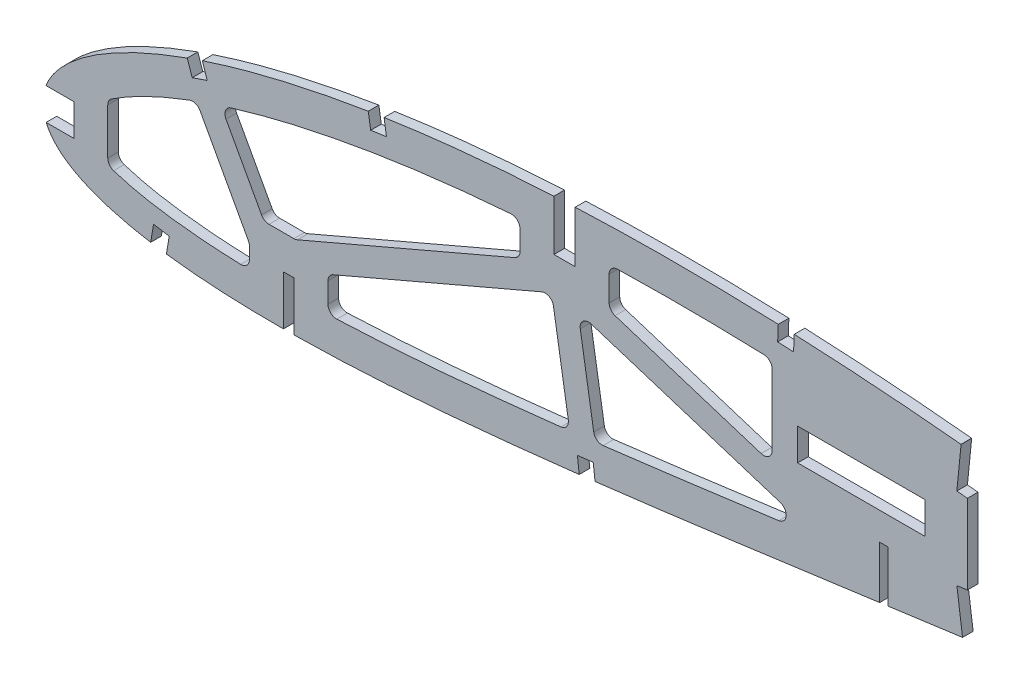
from build123d import *

# Parameters (mm, degrees)
BOSS_EXTRUDE1_DEPTH = 3.175
CUT_EXTRUDE1_DEPTH  = 7.62
SKETCH3_R           = 6.35
CUT_EXTRUDE2_DEPTH  = 7.62
SKETCH4_W           = 38.1
SKETCH4_H           = 9.525
SKETCH4_R           = 6.35
CUT_EXTRUDE3_DEPTH  = 443.627115857
CUT_EXTRUDE4_DEPTH  = 282.962875242
FILLET1_R           = 2.54


with BuildPart() as part:
    # Sketch1 → Boss-Extrude1 (new body)
    with BuildSketch(Plane.XY):
        with BuildLine():
            Line((435.33010469, 0.678691456), (439.172882547, -1.614212492))
            Line((439.172882547, -1.614212492), (434.787151486, -0.678691456))
            add(Edge.make_bspline(
                [(0, 0), (0.11179123, -0.527729161), (0.335887463, -1.58561283), (0.94472768, -3.108527015), (1.749889805, -4.572488672), (2.768272335, -5.973609192), (3.993104005, -7.311505618), (5.421679636, -8.587569541), (7.052598221, -9.801114861), (8.883725224, -10.951589231), (10.912400596, -12.040213999), (13.136344152, -13.066312264), (15.553528081, -14.029563428), (18.161318821, -14.928679795), (20.956528242, -15.765030781), (23.936498821, -16.536578215), (27.097842034, -17.244400464), (30.437517266, -17.886690773), (33.951885298, -18.464101669), (37.637295209, -18.976309975), (41.489964184, -19.423636044), (45.506112459, -19.80514129), (49.681767661, -20.121646285), (54.012767863, -20.373360955), (58.494909036, -20.561083494), (63.123897762, -20.684100336), (67.895200479, -20.744329207), (72.804505265, -20.742674403), (77.847009648, -20.678693244), (83.018406129, -20.555920262), (88.313732191, -20.373577887), (93.728207214, -20.133872554), (99.256947275, -19.839216685), (104.89499369, -19.49060908), (110.637384794, -19.089594814), (116.479134607, -18.639389777), (122.414936441, -18.141116951), (128.439613477, -17.597680601), (134.547832047, -17.011801372), (140.734314746, -16.385333349), (146.993600903, -15.721223571), (153.320115485, -15.021624036), (159.708476563, -14.290267097), (166.152848405, -13.528475979), (172.647781594, -12.740600204), (179.187166024, -11.928145018), (185.765533466, -11.094239816), (192.376967293, -10.242811017), (199.015278084, -9.37376151), (205.674882543, -8.493282903), (212.349358377, -7.600650086), (219.032895906, -6.7004538), (225.719308248, -5.795492203), (232.402082768, -4.886043807), (239.075345122, -3.975877517), (245.732904616, -3.06749205), (252.368240069, -2.160970285), (258.975348295, -1.26081803), (265.547576185, -0.366925322), (272.078863439, 0.518895586), (278.562951189, 1.394000598), (284.993721977, 2.257285217), (291.364542133, 3.108203268), (297.66900214, 3.947074317), (303.806375969, 4.748436439), (309.760626579, 5.554962658), (315.551818652, 6.216135275), (321.27090305, 6.780469964), (326.923820465, 7.243146515), (332.503782957, 7.610821489), (338.004397185, 7.886122043), (343.419107553, 8.072891719), (348.74107448, 8.176671364), (353.963650696, 8.200094537), (359.079707468, 8.150631139), (364.082590991, 8.032268225), (368.965318868, 7.850318702), (373.721079318, 7.610921079), (378.343117125, 7.320601554), (382.824493294, 6.983642622), (387.158963185, 6.607910686), (391.339839301, 6.198906082), (395.360701925, 5.761301701), (399.215684034, 5.304267166), (402.898615263, 4.830811549), (406.403955911, 4.348715399), (409.726063296, 3.862864382), (412.859676284, 3.379461168), (415.799871302, 2.903117573), (418.541899149, 2.440155772), (421.081464376, 1.994901374), (423.414160264, 1.571702591), (425.536750687, 1.175899009), (427.445043551, 0.809456817), (429.136486586, 0.478415007), (430.607934716, 0.184234372), (431.857230885, -0.068940506), (432.88219343, -0.280110359), (433.681265576, -0.445808771), (434.252869013, -0.566300363), (434.596385478, -0.637999126), (434.749014267, -0.670556399), (434.787151486, -0.678691456)],
                knots=[0, 0, 0, 0, 0.003638255, 0.007293231, 0.011028136, 0.014901081, 0.018963272, 0.023258475, 0.027820626, 0.032679082, 0.03785316, 0.043361875, 0.049214679, 0.055422346, 0.061988786, 0.068918036, 0.076211157, 0.083868392, 0.091887411, 0.100265912, 0.108999867, 0.118084529, 0.127514843, 0.13728527, 0.147387917, 0.157816481, 0.168563473, 0.179619128, 0.190977373, 0.202626974, 0.214560478, 0.226767249, 0.239236417, 0.251959004, 0.264923894, 0.278119703, 0.291536035, 0.30516028, 0.318980685, 0.332985499, 0.34716279, 0.361498603, 0.375980747, 0.390597192, 0.405332593, 0.420174823, 0.435109533, 0.450124276, 0.465203068, 0.480333154, 0.495500583, 0.510689775, 0.525887334, 0.541078314, 0.556247233, 0.571381785, 0.58646604, 0.601484515, 0.616424329, 0.631269423, 0.646006524, 0.660620684, 0.675098187, 0.689422858, 0.703581825, 0.716907563, 0.730009274, 0.742952128, 0.755725557, 0.768319951, 0.780724337, 0.792926528, 0.804916041, 0.816679084, 0.828203525, 0.8394749, 0.850481359, 0.861207697, 0.871639326, 0.881763414, 0.891563605, 0.901027365, 0.910138977, 0.918883977, 0.927249278, 0.935221104, 0.942784739, 0.949928188, 0.956638465, 0.962904203, 0.968712288, 0.974054485, 0.978918432, 0.983297219, 0.987180246, 0.990560674, 0.993433357, 0.995790626, 0.997629588, 0.998945816, 0.999736592, 1, 1, 1, 1], degree=3))
            add(Edge.make_bspline(
                [(435.33010469, 0.678691456), (435.296755582, 0.699293055), (435.163488681, 0.781619431), (434.863214309, 0.965803828), (434.363194901, 1.272571896), (433.663211466, 1.69979322), (432.763807452, 2.246333125), (431.664530435, 2.908364558), (430.366066728, 3.683736897), (428.86873043, 4.568782589), (427.172675107, 5.559358025), (425.278546429, 6.651449737), (423.186509465, 7.838875427), (420.897374442, 9.116782681), (418.411926851, 10.4790944), (415.730636684, 11.919657082), (412.854464224, 13.43114364), (409.784513475, 15.00705265), (406.521344218, 16.638681918), (403.066494801, 18.319240705), (399.421116368, 20.040349747), (395.586453278, 21.79282696), (391.56470833, 23.569527811), (387.356993489, 25.359407096), (382.965706604, 27.15470981), (378.392717175, 28.945218407), (373.640732922, 30.722778715), (368.711587102, 32.475875028), (363.608964359, 34.196846251), (358.335340013, 35.87451254), (352.894485425, 37.499762392), (347.289561815, 39.062058655), (341.52524157, 40.553388886), (335.605180365, 41.962892679), (329.534395845, 43.28113527), (323.317713598, 44.500180123), (316.960347344, 45.607856696), (310.479914041, 46.603301327), (303.980682286, 47.431342852), (297.494822244, 48.243461645), (291.0186212, 49.006373108), (284.46326746, 49.736966294), (277.835067652, 50.431127833), (271.140596349, 51.086687253), (264.386630807, 51.700815013), (257.580189535, 52.27171033), (250.727858804, 52.796138155), (243.836864005, 53.273290553), (236.914017847, 53.698972807), (229.966694004, 54.072865307), (223.001944897, 54.392360355), (216.027018499, 54.655256617), (209.049321182, 54.859966995), (202.076096041, 55.004530305), (195.114893299, 55.088037667), (188.172953688, 55.108207309), (181.257823923, 55.064678381), (174.376745271, 54.95595632), (167.537272154, 54.780552763), (160.7466557, 54.538140281), (154.012238926, 54.228824112), (147.341395315, 53.850013849), (140.741361553, 53.404123644), (134.219487317, 52.889280335), (127.782938298, 52.305347044), (121.438460058, 51.65475786), (115.193116172, 50.935743156), (109.053599754, 50.150348891), (103.026626206, 49.300114834), (97.118957953, 48.384577869), (91.33692342, 47.406382542), (85.686763085, 46.366529581), (80.174454785, 45.268067638), (74.805999973, 44.111283189), (69.587081438, 42.899646299), (64.52312301, 41.635267927), (59.619568317, 40.320462769), (54.881388132, 38.958385816), (50.313373811, 37.552127128), (45.920850559, 36.103231966), (41.707138151, 34.617193881), (37.677412709, 33.095067788), (33.834761135, 31.541542875), (30.183686712, 29.958740393), (26.726916941, 28.351485511), (23.468364091, 26.721608068), (20.41035055, 25.073674406), (17.555946308, 23.410211446), (14.907899047, 21.73430892), (12.467321746, 20.050217809), (10.237579271, 18.35899521), (8.219437586, 16.664914738), (6.414173801, 14.97055608), (4.824368385, 13.277086383), (3.449964137, 11.587487839), (2.292762263, 9.903098559), (1.352963468, 8.225512409), (0.632693499, 6.555947979), (0.13123808, 4.895344207), (-0.143255259, 3.246152095), (-0.211578297, 1.607049514), (-0.07042072, 0.534882766), (0, 0)],
                knots=[0, 0, 0, 0, 0.00025409, 0.001015373, 0.002283359, 0.004056577, 0.006330982, 0.009105274, 0.012374489, 0.016134023, 0.02037966, 0.025105976, 0.030306237, 0.035972206, 0.042099522, 0.048678064, 0.055701664, 0.063160184, 0.071045824, 0.079349826, 0.08806291, 0.097175756, 0.106678112, 0.116561573, 0.126814275, 0.137428301, 0.148393618, 0.15969976, 0.171338126, 0.183297699, 0.195569604, 0.208143556, 0.221011593, 0.234161831, 0.24758745, 0.261276822, 0.27522271, 0.289414144, 0.303771199, 0.317689227, 0.331784111, 0.346039677, 0.36044387, 0.37498272, 0.389640454, 0.404403316, 0.419256601, 0.434186749, 0.449177265, 0.464214782, 0.479284009, 0.49436974, 0.509457833, 0.524532346, 0.53957932, 0.554582984, 0.569529546, 0.584403417, 0.599190992, 0.613876838, 0.628447475, 0.642888675, 0.657186054, 0.671325546, 0.685294014, 0.699078147, 0.712665095, 0.726042645, 0.739197713, 0.752117586, 0.764792042, 0.777208152, 0.789355685, 0.80122396, 0.812803686, 0.824082909, 0.835054602, 0.845709571, 0.856037853, 0.866033834, 0.875688843, 0.884997719, 0.893953426, 0.902552897, 0.910789386, 0.918660734, 0.926166253, 0.933302626, 0.94007122, 0.94647478, 0.952517526, 0.958204819, 0.963546652, 0.9685566, 0.973249913, 0.977651041, 0.981787043, 0.985694226, 0.989415109, 0.993001157, 0.996508416, 1, 1, 1, 1], degree=3))
        make_face()
    extrude(amount=BOSS_EXTRUDE1_DEPTH)

    # Sketch2 → Cut-Extrude1 (cut)
    with BuildSketch(Plane(origin=(0, 0, 0), x_dir=(-1, 0, 0), z_dir=(0, 0, -1))):
        Polygon((-252.794440989, 13.221493744), (-250.254440989, 13.221493744), (-250.254440989, -2.115243028), (-250.254440989, -3.986349358), (-252.794440989, -3.050796193), (-252.794440989, -2.115243028), align=None)
        Polygon((-159.131940989, 54.422217902), (-159.131940989, 39.039100326), (-152.781940989, 39.039100326), (-152.781940989, 54.422217902), (-152.781940989, 57.645440557), (-159.131940989, 55.540936844), align=None)
        Polygon((-74.994440989, -5.928775484), (-74.994440989, -20.141805429), (-74.994440989, -20.97642061), (-71.819440989, -22.145862066), (-71.819440989, -20.141805429), (-71.819440989, -5.928775484), align=None)
    extrude(amount=-CUT_EXTRUDE1_DEPTH, mode=Mode.SUBTRACT)

    # Sketch3 → Cut-Extrude2 (cut)
    with BuildSketch(Plane(origin=(0, 0, 0), x_dir=(-1, 0, 0), z_dir=(0, 0, -1))):
        with Locations((-292.383806588, 26.255421435)):
            Circle(SKETCH3_R)
    extrude(amount=-CUT_EXTRUDE2_DEPTH, mode=Mode.SUBTRACT)

    # Sketch4 → Cut-Extrude3 (cut, through all)
    # profile 1 of 12: a face of its own
    with BuildSketch(Plane.XY.offset(3.175)):
        with BuildLine():
            Line((9.08354865, 6.810338827), (0.76430461, 6.810338827))
            add(Edge.make_bspline(
                [(0.76430461, 6.810338827), (0.726676763, 6.71299191), (0.488212559, 6.077489506), (0.13123808, 4.895344207), (-0.143255259, 3.246152095), (-0.211578297, 1.607049514), (-0.07042072, 0.534882766), (0, 0)],
                knots=[0.98501809, 0.98501809, 0.98501809, 0.98501809, 0.985694226, 0.989415109, 0.993001157, 0.996508416, 1, 1, 1, 1], degree=3))
            add(Edge.make_bspline(
                [(0, 0), (0.11179123, -0.527729161), (0.307969583, -1.453821818), (0.640979835, -2.341032636), (0.803006074, -2.714661173)],
                knots=[0, 0, 0, 0, 0.003638255, 0.006384641, 0.006384641, 0.006384641, 0.006384641], degree=3))
            Line((0.803006074, -2.714661173), (9.08354865, -2.714661173))
            Line((9.08354865, -2.714661173), (9.08354865, 6.810338827))
        make_face()
    # profile 2 of 12: a face of its own
    with BuildSketch(Plane.XY.offset(3.175)):
        with BuildLine():
            Line((49.020517996, 32.253888691), (47.531675541, 36.629642878))
            add(Edge.make_bspline(
                [(47.531675541, 36.629642878), (46.979087567, 36.445759538), (45.474608141, 35.938686183), (43.975608762, 35.415532918), (43.028960398, 35.077347923)],
                knots=[0.862258912, 0.862258912, 0.862258912, 0.862258912, 0.866033834, 0.872549698, 0.872549698, 0.872549698, 0.872549698], degree=3))
            Line((43.028960398, 35.077347923), (44.512019179, 30.71972624))
            Line((44.512019179, 30.71972624), (49.020517996, 32.253888691))
        make_face()
    # profile 3 of 12: a face of its own
    with BuildSketch(Plane.XY.offset(3.175)):
        Polygon((36.838817299, -18.581245887), (32.165910286, -17.731153874), (32.952371753, -13.02357497), (37.641753761, -13.808241987), align=None)
    # profile 4 of 12: a face of its own
    with BuildSketch(Plane.XY.offset(3.175)):
        with BuildLine():
            Line((102.645386654, 44.510393866), (101.9478561, 49.125267329))
            add(Edge.make_bspline(
                [(101.9478561, 49.125267329), (100.365650198, 48.887111331), (98.784740474, 48.64033843), (97.205261705, 48.38471328)],
                knots=[0.741480352, 0.741480352, 0.741480352, 0.741480352, 0.751851659, 0.751851659, 0.751851659, 0.751851659], degree=3))
            Line((97.205261705, 48.38471328), (97.936400792, 43.798607145))
            Line((97.936400792, 43.798607145), (102.645386654, 44.510393866))
        make_face()
    # profile 5 of 12: a face of its own
    with BuildSketch(Plane.XY.offset(3.175)):
        with BuildLine():
            add(Edge.make_bspline(
                [(160.340338786, -14.212647666), (161.920044437, -14.028275741), (163.499504121, -13.841797301), (165.078745983, -13.653492366)],
                knots=[0.377458898, 0.377458898, 0.377458898, 0.377458898, 0.388202054, 0.388202054, 0.388202054, 0.388202054], degree=3))
            Line((165.078745983, -13.653492366), (164.522590598, -8.953423812))
            Line((164.522590598, -8.953423812), (159.793087001, -9.513059826))
            Line((159.793087001, -9.513059826), (160.340338786, -14.212647666))
        make_face()
    # profile 6 of 12: a face of its own
    with BuildSketch(Plane.XY.offset(3.175)):
        with BuildLine():
            Line((224.483551568, 49.643099482), (224.695252101, 54.310425843))
            add(Edge.make_bspline(
                [(224.695252101, 54.310425843), (224.131555977, 54.335094277), (222.536497131, 54.403324951), (220.941251233, 54.467084737), (219.909719875, 54.506423891)],
                knots=[0.475626644, 0.475626644, 0.475626644, 0.475626644, 0.479284009, 0.485975235, 0.485975235, 0.485975235, 0.485975235], degree=3))
            Line((219.909719875, 54.506423891), (219.725798523, 49.849814949))
            Line((219.725798523, 49.849814949), (224.483551568, 49.643099482))
        make_face()
    # profile 7 of 12: a face of its own
    with BuildSketch(Plane.XY.offset(3.175)):
        with Locations((244.758806588, 26.255421435)):
            Rectangle(SKETCH4_W, SKETCH4_H)
    # profile 8 of 12: a face of its own
    with BuildSketch(Plane.XY.offset(3.175)):
        Polygon((276.508806588, 37.713859181), (277.787367709, 50.342830172), (274.606587067, 50.664683683), (273.349658498, 38.028091323), align=None)
    # profile 9 of 12: a face of its own
    with BuildSketch(Plane.XY.offset(3.175)):
        with BuildLine():
            Line((274.606587067, 50.745349283), (274.606587067, 50.664683683))
            Line((274.606587067, 50.664683683), (277.787367709, 50.342830172))
            Line((277.787367709, 50.342830172), (276.508806588, 37.713859181))
            Line((276.508806588, 37.713859181), (276.508806588, 13.934637567))
            Line((276.508806588, 13.934637567), (278.202158297, 1.347675194))
            Line((278.202158297, 1.347675194), (275.057635426, 0.924468904))
            Line((275.057635426, 0.924468904), (275.057635426, 0.920727129))
            add(Edge.make_bspline(
                [(275.057635426, 0.920727129), (276.232091103, 1.079260303), (279.550679689, 1.526596029), (284.993721977, 2.257285217), (291.364542133, 3.108203268), (297.66900214, 3.947074317), (303.806375969, 4.748436439), (309.760626579, 5.554962658), (315.551818652, 6.216135275), (321.27090305, 6.780469964), (326.923820465, 7.243146515), (332.503782957, 7.610821489), (338.004397185, 7.886122043), (343.419107553, 8.072891719), (348.74107448, 8.176671364), (353.963650696, 8.200094537), (359.079707468, 8.150631139), (364.082590991, 8.032268225), (368.965318868, 7.850318702), (373.721079318, 7.610921079), (378.343117125, 7.320601554), (382.824493294, 6.983642622), (387.158963185, 6.607910686), (391.339839301, 6.198906082), (395.360701925, 5.761301701), (399.215684034, 5.304267166), (402.898615263, 4.830811549), (406.403955911, 4.348715399), (409.726063296, 3.862864382), (412.859676284, 3.379461168), (415.799871302, 2.903117573), (418.541899149, 2.440155772), (421.081464376, 1.994901374), (423.414160264, 1.571702591), (425.536750687, 1.175899009), (427.445043551, 0.809456817), (429.136486586, 0.478415007), (430.607934716, 0.184234372), (431.857230885, -0.068940506), (432.88219343, -0.280110359), (433.681265576, -0.445808771), (434.252869013, -0.566300363), (434.596385478, -0.637999126), (434.749014267, -0.670556399), (434.787151486, -0.678691456)],
                knots=[0.638001263, 0.638001263, 0.638001263, 0.638001263, 0.646006524, 0.660620684, 0.675098187, 0.689422858, 0.703581825, 0.716907563, 0.730009274, 0.742952128, 0.755725557, 0.768319951, 0.780724337, 0.792926528, 0.804916041, 0.816679084, 0.828203525, 0.8394749, 0.850481359, 0.861207697, 0.871639326, 0.881763414, 0.891563605, 0.901027365, 0.910138977, 0.918883977, 0.927249278, 0.935221104, 0.942784739, 0.949928188, 0.956638465, 0.962904203, 0.968712288, 0.974054485, 0.978918432, 0.983297219, 0.987180246, 0.990560674, 0.993433357, 0.995790626, 0.997629588, 0.998945816, 0.999736592, 1, 1, 1, 1], degree=3))
            Line((434.787151486, -0.678691456), (439.172882547, -1.614212492))
            Line((439.172882547, -1.614212492), (435.33010469, 0.678691456))
            add(Edge.make_bspline(
                [(435.33010469, 0.678691456), (435.296755582, 0.699293055), (435.163488681, 0.781619431), (434.863214309, 0.965803828), (434.363194901, 1.272571896), (433.663211466, 1.69979322), (432.763807452, 2.246333125), (431.664530435, 2.908364558), (430.366066728, 3.683736897), (428.86873043, 4.568782589), (427.172675107, 5.559358025), (425.278546429, 6.651449737), (423.186509465, 7.838875427), (420.897374442, 9.116782681), (418.411926851, 10.4790944), (415.730636684, 11.919657082), (412.854464224, 13.43114364), (409.784513475, 15.00705265), (406.521344218, 16.638681918), (403.066494801, 18.319240705), (399.421116368, 20.040349747), (395.586453278, 21.79282696), (391.56470833, 23.569527811), (387.356993489, 25.359407096), (382.965706604, 27.15470981), (378.392717175, 28.945218407), (373.640732922, 30.722778715), (368.711587102, 32.475875028), (363.608964359, 34.196846251), (358.335340013, 35.87451254), (352.894485425, 37.499762392), (347.289561815, 39.062058655), (341.52524157, 40.553388886), (335.605180365, 41.962892679), (329.534395845, 43.28113527), (323.317713598, 44.500180123), (316.960347344, 45.607856696), (310.479914041, 46.603301327), (303.980682286, 47.431342852), (297.494822244, 48.243461645), (291.0186212, 49.006373108), (284.46326746, 49.736966294), (278.983592298, 50.31084455), (275.689561404, 50.639206846), (274.606587067, 50.745349283)],
                knots=[0, 0, 0, 0, 0.00025409, 0.001015373, 0.002283359, 0.004056577, 0.006330982, 0.009105274, 0.012374489, 0.016134023, 0.02037966, 0.025105976, 0.030306237, 0.035972206, 0.042099522, 0.048678064, 0.055701664, 0.063160184, 0.071045824, 0.079349826, 0.08806291, 0.097175756, 0.106678112, 0.116561573, 0.126814275, 0.137428301, 0.148393618, 0.15969976, 0.171338126, 0.183297699, 0.195569604, 0.208143556, 0.221011593, 0.234161831, 0.24758745, 0.261276822, 0.27522271, 0.289414144, 0.303771199, 0.317689227, 0.331784111, 0.346039677, 0.36044387, 0.367497329, 0.367497329, 0.367497329, 0.367497329], degree=3))
        make_face()
        with Locations((292.383806588, 26.255421435)):
            Circle(SKETCH4_R, mode=Mode.SUBTRACT)
    # profile 10 of 12: a face of its own
    with BuildSketch(Plane.XY.offset(3.175)):
        Polygon((273.362227422, 13.510785566), (275.057635426, 0.924468904), (278.202158297, 1.347675194), (276.508806588, 13.934637567), align=None)
    # profile 11 of 12: a face of its own
    with BuildSketch(Plane.XY.offset(3.175)):
        with BuildLine():
            add(Edge.make_bspline(
                [(32.095086313, -18.155090016), (32.696595442, -18.254411923), (34.259232792, -18.501714728), (35.825676123, -18.723786999), (36.789618427, -18.851689263)],
                knots=[0.087769382, 0.087769382, 0.087769382, 0.087769382, 0.091887411, 0.098455639, 0.098455639, 0.098455639, 0.098455639], degree=3))
            Line((32.095086313, -18.155090016), (31.569110721, -21.303459904))
            Line((31.569110721, -21.303459904), (36.2027681, -22.077571832))
            Line((36.2027681, -22.077571832), (36.789618427, -18.851689263))
        make_face()
    # profile 12 of 12: a face of its own
    with BuildSketch(Plane.XY.offset(3.175)):
        with BuildLine():
            Line((32.165910286, -17.731153874), (32.095086313, -18.155090016))
            add(Edge.make_bspline(
                [(32.095086313, -18.155090016), (32.696595442, -18.254411923), (34.259232792, -18.501714728), (35.825676123, -18.723786999), (36.789618427, -18.851689263)],
                knots=[0.087769382, 0.087769382, 0.087769382, 0.087769382, 0.091887411, 0.098455639, 0.098455639, 0.098455639, 0.098455639], degree=3))
            Line((36.789618427, -18.851689263), (36.838817299, -18.581245887))
            Line((36.838817299, -18.581245887), (32.165910286, -17.731153874))
        make_face()
    extrude(amount=-CUT_EXTRUDE3_DEPTH, mode=Mode.SUBTRACT)

    # Sketch5 → Cut-Extrude4 (cut, through all)
    with BuildSketch(Plane.XY.offset(3.175)):
        with BuildLine():
            add(Edge.make_bspline(
                [(45.814840569, 25.282367443), (43.822791815, 24.562865162), (39.215196122, 22.812244039), (32.181765676, 19.775215547), (26.104065444, 16.671015264), (22.150956813, 14.309546417), (20.27302683, 13.083140574), (19.503800794, 12.556245905), (19.24354865, 12.374877898)],
                knots=[0.874077053, 0.874077053, 0.874077053, 0.874077053, 0.888527775, 0.907825838, 0.927123901, 0.936772932, 0.94141287, 0.943825127, 0.943825127, 0.943825127, 0.943825127], degree=3))
            Line((19.24354865, 12.374877898), (19.24354865, -4.539137798))
            add(Edge.make_bspline(
                [(19.24354865, -4.539137798), (19.525981613, -4.642890342), (20.216795523, -4.889295377), (22.0966215, -5.515008888), (26.203155938, -6.690360656), (32.713182772, -8.045600453), (40.841334575, -9.183638157), (49.096619858, -9.934839763), (55.360075179, -10.273048988), (59.539003509, -10.420924337), (60.952190291, -10.460753472), (61.659440989, -10.478274979)],
                knots=[0.049763351, 0.049763351, 0.049763351, 0.049763351, 0.052230608, 0.055729778, 0.065598805, 0.08533686, 0.105074914, 0.124812969, 0.144188224, 0.149122738, 0.154057251, 0.154057251, 0.154057251, 0.154057251], degree=3))
            Line((61.659440989, -10.478274979), (61.659440989, -3.714397612))
            Line((61.659440989, -3.714397612), (45.814840569, 25.282367443))
        make_face()
        with BuildLine():
            add(Edge.make_bspline(
                [(142.621940989, 43.341052807), (141.16277336, 43.237100158), (137.894505535, 42.99177607), (128.804678048, 42.228619487), (115.386854733, 40.817080153), (98.089203191, 38.358558503), (80.973623404, 35.187832938), (66.936657893, 31.856735994), (57.726991023, 29.21501171), (54.069296834, 28.07024065), (53.137796451, 27.772072652)],
                knots=[0.654625525, 0.654625525, 0.654625525, 0.654625525, 0.664274557, 0.676249084, 0.714845209, 0.753441335, 0.792037461, 0.830633587, 0.84993165, 0.856554759, 0.856554759, 0.856554759, 0.856554759], degree=3))
            Line((53.137796451, 27.772072652), (66.001139364, 4.231224516))
            Line((66.001139364, 4.231224516), (75.488690109, 4.231224516))
            Line((75.488690109, 4.231224516), (142.621940989, 33.024751821))
            Line((142.621940989, 33.024751821), (142.621940989, 43.341052807))
        make_face()
        with BuildLine():
            Line((85.154440989, 0.085573021), (85.154440989, -10.31403894))
            add(Edge.make_bspline(
                [(85.154440989, -10.31403894), (90.221688375, -10.141635354), (101.039010532, -9.613219564), (117.637914667, -8.40013339), (136.679570306, -6.638548813), (149.971615588, -5.18667662), (157.497572739, -4.315203925)],
                knots=[0.208311845, 0.208311845, 0.208311845, 0.208311845, 0.243241296, 0.282717405, 0.322193514, 0.373662797, 0.373662797, 0.373662797, 0.373662797], degree=3))
            Line((157.497572739, -4.315203925), (152.109291457, 28.802584187))
            Line((152.109291457, 28.802584187), (85.154440989, 0.085573021))
        make_face()
        with BuildLine():
            Line((159.987096536, 27.833886694), (165.07247877, -3.422204529))
            add(Edge.make_bspline(
                [(165.07247877, -3.422204529), (166.566956941, -3.243055154), (179.610552739, -1.664978362), (201.671667742, 1.19592823), (222.259411165, 3.987166397), (231.282036291, 5.215897599)],
                knots=[0.390928193, 0.390928193, 0.390928193, 0.390928193, 0.401145733, 0.480097951, 0.541640306, 0.541640306, 0.541640306, 0.541640306], degree=3))
            Line((231.282036291, 5.215897599), (159.987096536, 27.833886694))
        make_face()
        with BuildLine():
            add(Edge.make_bspline(
                [(218.088806588, 44.407248442), (215.149456111, 44.514285011), (209.270778872, 44.697237468), (195.225915283, 44.981634592), (181.89596248, 44.964543834), (171.518848439, 44.720101194), (169.291940989, 44.656607646)],
                knots=[0.489112922, 0.489112922, 0.489112922, 0.489112922, 0.508410985, 0.527709048, 0.581332198, 0.595990863, 0.595990863, 0.595990863, 0.595990863], degree=3))
            Line((169.291940989, 44.656607646), (169.291940989, 32.87623272))
            Line((169.291940989, 32.87623272), (218.088806588, 17.395653345))
            Line((218.088806588, 17.395653345), (218.088806588, 38.637921435))
            Line((218.088806588, 38.637921435), (218.088806588, 44.407248442))
        make_face()
    extrude(amount=-CUT_EXTRUDE4_DEPTH, mode=Mode.SUBTRACT)

    # Fillet1
    fillet1_edges = [part.edges().sort_by_distance(p)[0] for p in [
        (169.291940989, 32.87623272, 1.5875),
        (169.291940989, 44.656607646, 1.5875),
        (218.088806588, 44.407248442, 1.5875),
        (218.088806588, 17.395653345, 1.5875),
        (19.24354865, 12.374877898, 1.5875),
        (45.814840569, 25.282367443, 1.5875),
        (61.659440989, -3.714397612, 1.5875),
        (19.24354865, -4.539137798, 1.5875),
        (85.154440989, 0.085573021, 1.5875),
        (152.109291457, 28.802584187, 1.5875),
        (157.497572739, -4.315203925, 1.5875),
        (85.154440989, -10.31403894, 1.5875),
        (142.621940989, 33.024751821, 1.5875),
        (75.488690109, 4.231224516, 1.5875),
        (66.001139364, 4.231224516, 1.5875),
        (53.137796451, 27.772072652, 1.5875),
        (142.621940989, 43.341052807, 1.5875),
        (159.987096536, 27.833886694, 1.5875),
        (231.282036291, 5.215897599, 1.5875),
        (165.07247877, -3.422204529, 1.5875),
        (61.659440989, -10.478274979, 1.5875),
    ]]
    fillet(fillet1_edges, radius=FILLET1_R)


solid = part.part
